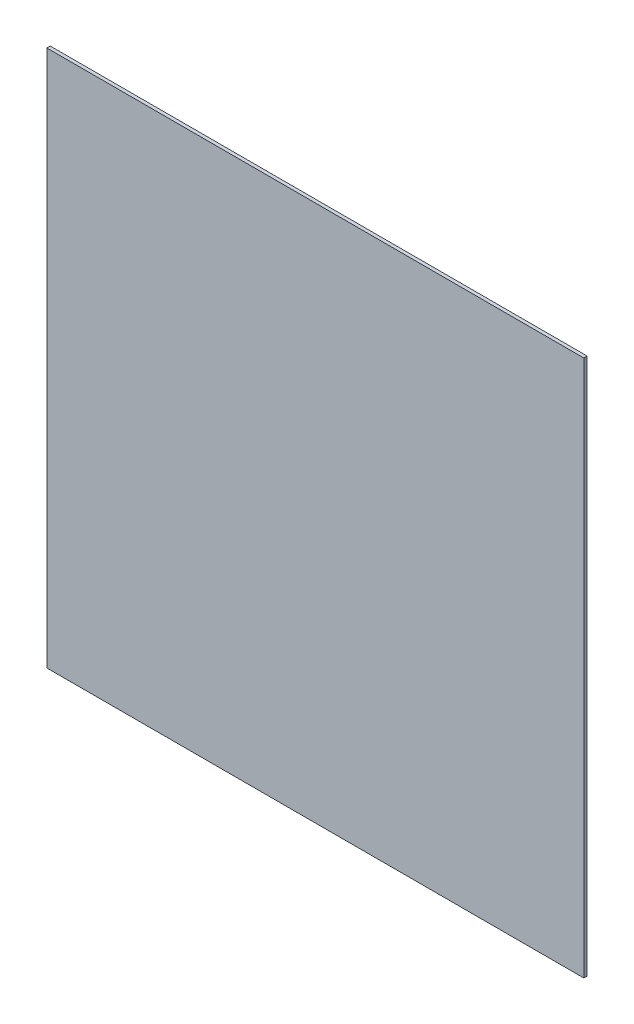
from build123d import *

# Parameters (mm, degrees)
SKETCH1_W      = 31.75
SKETCH1_H      = 31.75
EXTRUDE1_DEPTH = 0.2


with BuildPart() as part:
    # Sketch1 → Extrude1 (new body)
    with BuildSketch(Plane.XY):
        Rectangle(SKETCH1_W, SKETCH1_H)
    extrude(amount=EXTRUDE1_DEPTH)


solid = part.part
